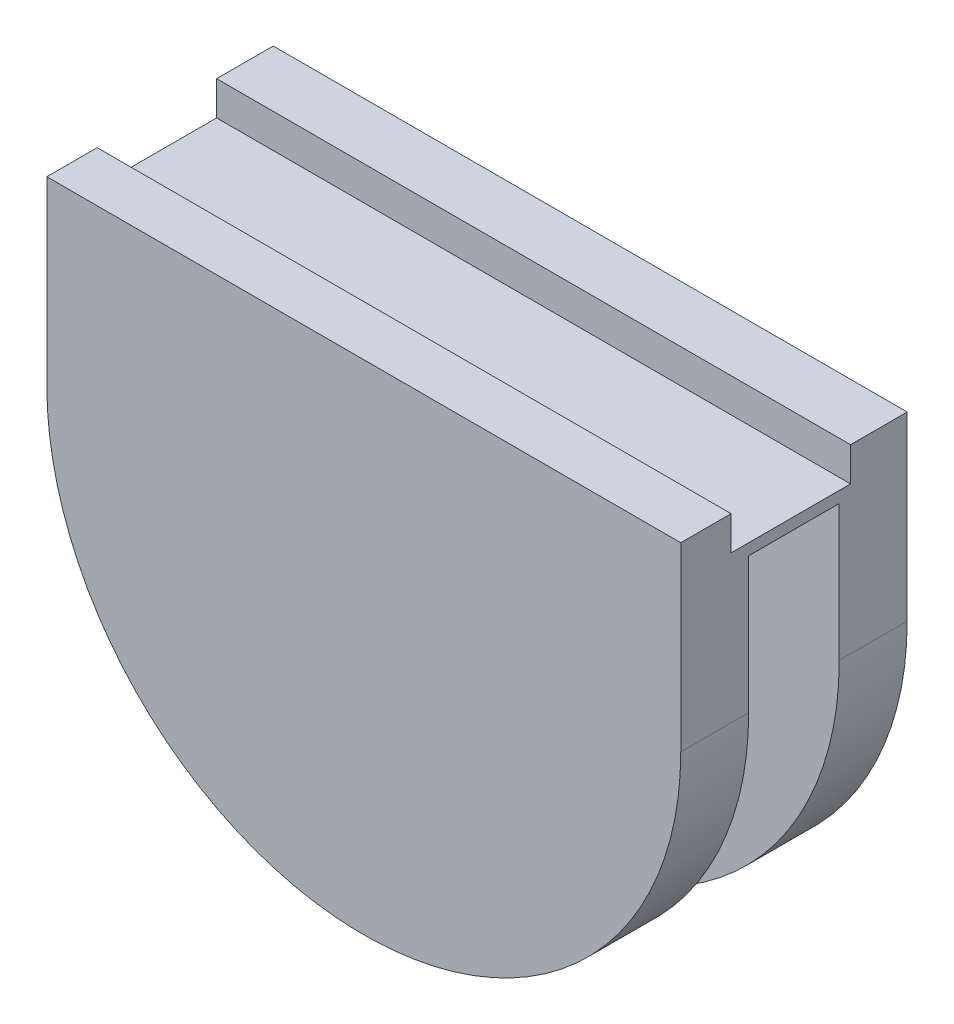
from build123d import *

# Parameters (mm, degrees)
BOSS_EXTRUDE1_DEPTH = 3
SKETCH2_W           = 28
SKETCH2_H           = 2
BOSS_EXTRUDE2_DEPTH = 4
BOSS_EXTRUDE3_START = 3
BOSS_EXTRUDE3_DEPTH = 3
SKETCH4_W           = 28
SKETCH4_H           = 5.276937717
CUT_EXTRUDE1_DEPTH  = 1.5


with BuildPart() as part:
    # Sketch1 → Boss-Extrude1 (new body)
    with BuildSketch(Plane.XY):
        with BuildLine():
            Line((-26.074492775, 2.891966759), (1.925507225, 2.891966759))
            Line((1.925507225, 2.891966759), (1.925507225, -5.108033241))
            ThreePointArc((1.925507225, -5.108033241), (-12.074492775, -19.108033241), (-26.074492775, -5.108033241))
            Line((-26.074492775, -5.108033241), (-26.074492775, 2.891966759))
        make_face()
    extrude(amount=BOSS_EXTRUDE1_DEPTH)

    # Sketch2 → Boss-Extrude2 (add)
    with BuildSketch(Plane(origin=(0, 0, 0), x_dir=(-1, 0, 0), z_dir=(0, 0, -1))):
        with Locations((12.074492775, 1.891966759)):
            Rectangle(SKETCH2_W, SKETCH2_H)
    extrude(amount=BOSS_EXTRUDE2_DEPTH)

    # Sketch3 → Boss-Extrude3 (add)
    with BuildSketch(Plane(origin=(0, 0, -4), x_dir=(-1, 0, 0), z_dir=(0, 0, -1)).offset(BOSS_EXTRUDE3_START)):
        with BuildLine():
            Line((-1.925507225, 2.891966759), (26.074492775, 2.891966759))
            Line((26.074492775, 2.891966759), (26.074492775, -5.108033241))
            ThreePointArc((26.074492775, -5.108033241), (12.074492775, -19.108033241), (-1.925507225, -5.108033241))
            Line((-1.925507225, -5.108033241), (-1.925507225, 2.891966759))
        make_face()
    extrude(amount=-BOSS_EXTRUDE3_DEPTH)

    # Sketch4 → Cut-Extrude1 (cut)
    with BuildSketch(Plane(origin=(0, 2.891966759, 0), x_dir=(1, 0, 0), z_dir=(0, 1, 0))):
        with Locations((-12.074492775, 1.861531141)):
            Rectangle(SKETCH4_W, SKETCH4_H)
    extrude(amount=-CUT_EXTRUDE1_DEPTH, mode=Mode.SUBTRACT)


solid = part.part
